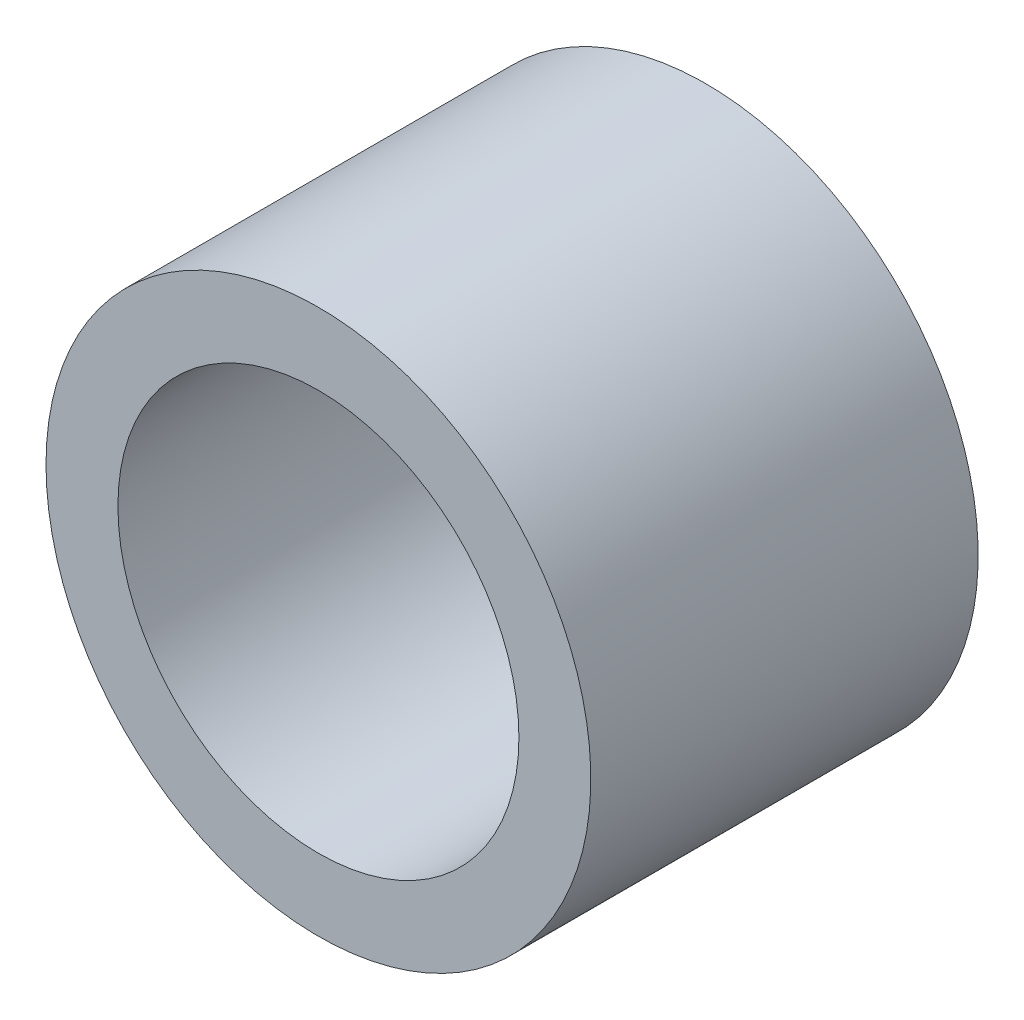
from build123d import *

# Parameters (mm, degrees)
SKETCH1_R           = 5.55625
SKETCH1_R_2         = 4.0894
BOSS_EXTRUDE1_DEPTH = 7.9


with BuildPart() as part:
    # Sketch1 → Boss-Extrude1 (new body)
    with BuildSketch(Plane.XY):
        with Locations(Location((0, 0, 0), (0, 0, 180))):
            Circle(SKETCH1_R)
        with Locations(Location((0, 0, 0), (0, 0, 180))):
            Circle(SKETCH1_R_2, mode=Mode.SUBTRACT)
    extrude(amount=BOSS_EXTRUDE1_DEPTH)


solid = part.part
